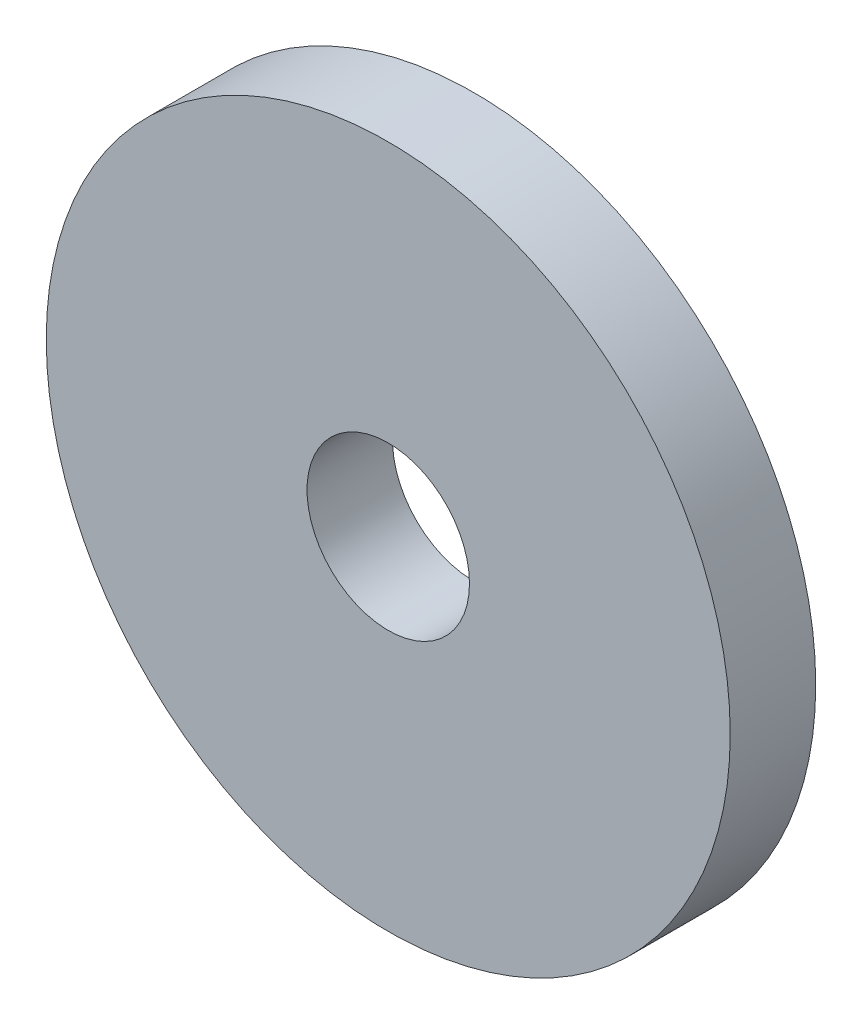
from build123d import *

# Parameters (mm, degrees)
SKETCH_1_R          = 40
EXTRUDE_4_DEPTH     = 10
SKETCH_2_R          = 9.5
CUT_EXTRUDE_1_DEPTH = 10


with BuildPart() as part:
    # 草图1 → 凸台-拉伸4 (new body)
    with BuildSketch(Plane.XY):
        with Locations((150.891565487, -14.889512115)):
            Circle(SKETCH_1_R)
    extrude(amount=EXTRUDE_4_DEPTH)

    # 草图2 → 切除-拉伸1 (cut)
    with BuildSketch(Plane.XY.offset(10)):
        with Locations((150.891565487, -14.889512115)):
            Circle(SKETCH_2_R)
    extrude(amount=-CUT_EXTRUDE_1_DEPTH, mode=Mode.SUBTRACT)


solid = part.part
